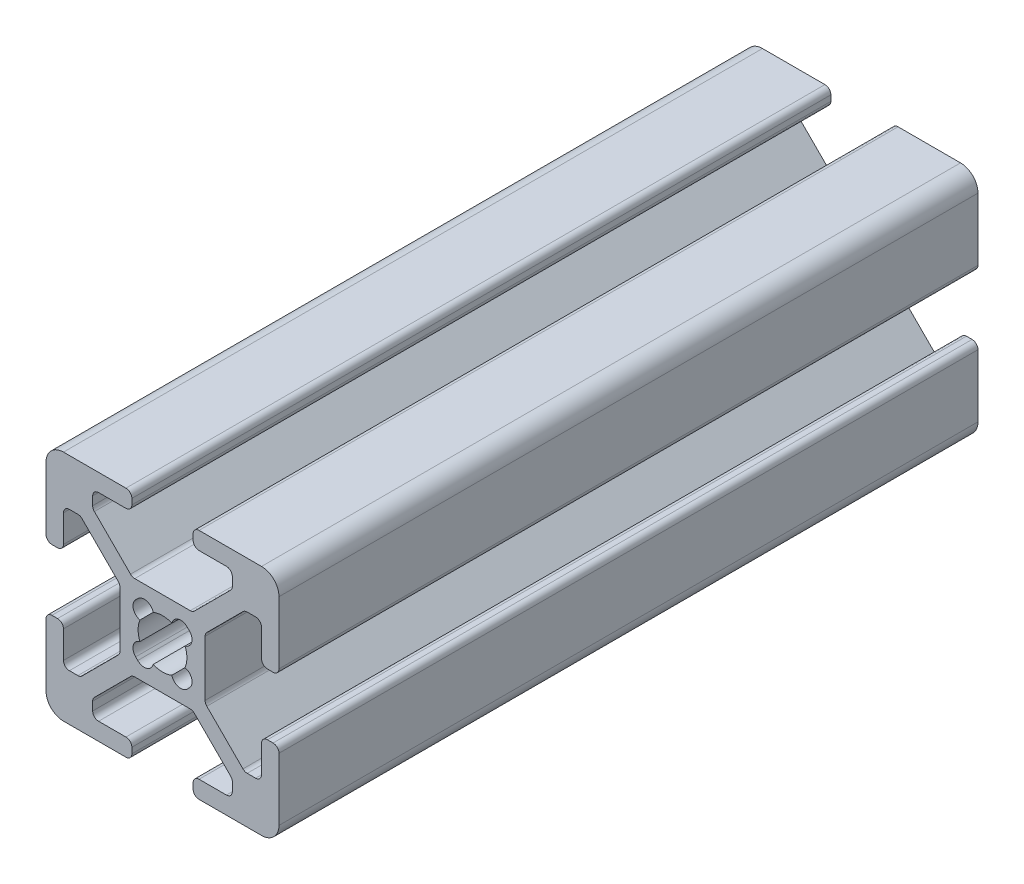
from build123d import *

# Parameters (mm, degrees)
BOSS_EXTRUDE1_DEPTH = 60


with BuildPart() as part:
    # Sketch2 → Boss-Extrude1 (new body)
    with BuildSketch(Plane.XY):
        with BuildLine():
            Line((-10, -3.138), (-10, -8.5))
            ThreePointArc((-10, -8.5), (-9.560660172, -9.560660172), (-8.5, -10))
            Line((-8.5, -10), (-3.138, -10))
            ThreePointArc((-3.138, -10), (-2.778789755, -9.851210245), (-2.63, -9.492))
            Line((-2.63, -9.492), (-2.63, -9.008))
            ThreePointArc((-2.63, -9.008), (-2.778789755, -8.648789755), (-3.138, -8.5))
            Line((-3.138, -8.5), (-5.487, -8.5))
            ThreePointArc((-5.487, -8.5), (-5.846210245, -8.351210245), (-5.995, -7.992))
            Line((-5.995, -7.992), (-5.995, -7.266240833))
            ThreePointArc((-5.995, -7.266240833), (-5.956330803, -7.07183765), (-5.846210245, -6.907030588))
            Line((-5.846210245, -6.907030588), (-2.742969412, -3.803789755))
            ThreePointArc((-2.742969412, -3.803789755), (-2.57816235, -3.693669197), (-2.383759167, -3.655))
            Line((-2.383759167, -3.655), (2.38407951, -3.655))
            ThreePointArc((2.38407951, -3.655), (2.578482694, -3.693669197), (2.743289755, -3.803789755))
            Line((2.743289755, -3.803789755), (5.846210245, -6.906710245))
            ThreePointArc((5.846210245, -6.906710245), (5.956330803, -7.071517306), (5.995, -7.26592049))
            Line((5.995, -7.26592049), (5.995, -7.992))
            ThreePointArc((5.995, -7.992), (5.846210245, -8.351210245), (5.487, -8.5))
            Line((5.487, -8.5), (3.138, -8.5))
            ThreePointArc((3.138, -8.5), (2.778789755, -8.648789755), (2.63, -9.008))
            Line((2.63, -9.008), (2.63, -9.492))
            ThreePointArc((2.63, -9.492), (2.778789755, -9.851210245), (3.138, -10))
            Line((3.138, -10), (8.5, -10))
            ThreePointArc((8.5, -10), (9.560660172, -9.560660172), (10, -8.5))
            Line((10, -8.5), (10, -3.138))
            ThreePointArc((10, -3.138), (9.851210245, -2.778789755), (9.492, -2.63))
            Line((9.492, -2.63), (9.008, -2.63))
            ThreePointArc((9.008, -2.63), (8.648789755, -2.778789755), (8.5, -3.138))
            Line((8.5, -3.138), (8.5, -5.487))
            ThreePointArc((8.5, -5.487), (8.351210245, -5.846210245), (7.992, -5.995))
            Line((7.992, -5.995), (7.266240833, -5.995))
            ThreePointArc((7.266240833, -5.995), (7.07183765, -5.956330803), (6.907030588, -5.846210245))
            Line((6.907030588, -5.846210245), (3.803789755, -2.742969412))
            ThreePointArc((3.803789755, -2.742969412), (3.693669197, -2.57816235), (3.655, -2.383759167))
            Line((3.655, -2.383759167), (3.655, 2.38407951))
            ThreePointArc((3.655, 2.38407951), (3.693669197, 2.578482694), (3.803789755, 2.743289755))
            Line((3.803789755, 2.743289755), (6.906710245, 5.846210245))
            ThreePointArc((6.906710245, 5.846210245), (7.071517306, 5.956330803), (7.26592049, 5.995))
            Line((7.26592049, 5.995), (7.992, 5.995))
            ThreePointArc((7.992, 5.995), (8.351210245, 5.846210245), (8.5, 5.487))
            Line((8.5, 5.487), (8.5, 3.138))
            ThreePointArc((8.5, 3.138), (8.648789755, 2.778789755), (9.008, 2.63))
            Line((9.008, 2.63), (9.492, 2.63))
            ThreePointArc((9.492, 2.63), (9.851210245, 2.778789755), (10, 3.138))
            Line((10, 3.138), (10, 8.5))
            ThreePointArc((10, 8.5), (9.560660172, 9.560660172), (8.5, 10))
            Line((8.5, 10), (3.138, 10))
            ThreePointArc((3.138, 10), (2.778789755, 9.851210245), (2.63, 9.492))
            Line((2.63, 9.492), (2.63, 9.008))
            ThreePointArc((2.63, 9.008), (2.778789755, 8.648789755), (3.138, 8.5))
            Line((3.138, 8.5), (5.487, 8.5))
            ThreePointArc((5.487, 8.5), (5.846210245, 8.351210245), (5.995, 7.992))
            Line((5.995, 7.992), (5.995, 7.266240833))
            ThreePointArc((5.995, 7.266240833), (5.956330803, 7.07183765), (5.846210245, 6.907030588))
            Line((5.846210245, 6.907030588), (2.742969412, 3.803789755))
            ThreePointArc((2.742969412, 3.803789755), (2.57816235, 3.693669197), (2.383759167, 3.655))
            Line((2.383759167, 3.655), (-2.38407951, 3.655))
            ThreePointArc((-2.38407951, 3.655), (-2.578482694, 3.693669197), (-2.743289755, 3.803789755))
            Line((-2.743289755, 3.803789755), (-5.846210245, 6.906710245))
            ThreePointArc((-5.846210245, 6.906710245), (-5.956330803, 7.071517306), (-5.995, 7.26592049))
            Line((-5.995, 7.26592049), (-5.995, 7.992))
            ThreePointArc((-5.995, 7.992), (-5.846210245, 8.351210245), (-5.487, 8.5))
            Line((-5.487, 8.5), (-3.138, 8.5))
            ThreePointArc((-3.138, 8.5), (-2.778789755, 8.648789755), (-2.63, 9.008))
            Line((-2.63, 9.008), (-2.63, 9.492))
            ThreePointArc((-2.63, 9.492), (-2.778789755, 9.851210245), (-3.138, 10))
            Line((-3.138, 10), (-8.5, 10))
            ThreePointArc((-8.5, 10), (-9.560660172, 9.560660172), (-10, 8.5))
            Line((-10, 8.5), (-10, 3.138))
            ThreePointArc((-10, 3.138), (-9.851210245, 2.778789755), (-9.492, 2.63))
            Line((-9.492, 2.63), (-9.008, 2.63))
            ThreePointArc((-9.008, 2.63), (-8.648789755, 2.778789755), (-8.5, 3.138))
            Line((-8.5, 3.138), (-8.5, 5.487))
            ThreePointArc((-8.5, 5.487), (-8.351210245, 5.846210245), (-7.992, 5.995))
            Line((-7.992, 5.995), (-7.266240833, 5.995))
            ThreePointArc((-7.266240833, 5.995), (-7.07183765, 5.956330803), (-6.907030588, 5.846210245))
            Line((-6.907030588, 5.846210245), (-3.803789755, 2.742969412))
            ThreePointArc((-3.803789755, 2.742969412), (-3.693669197, 2.57816235), (-3.655, 2.383759167))
            Line((-3.655, 2.383759167), (-3.655, -2.38407951))
            ThreePointArc((-3.655, -2.38407951), (-3.693669197, -2.578482694), (-3.803789755, -2.743289755))
            Line((-3.803789755, -2.743289755), (-6.906710245, -5.846210245))
            ThreePointArc((-6.906710245, -5.846210245), (-7.071517306, -5.956330803), (-7.26592049, -5.995))
            Line((-7.26592049, -5.995), (-7.992, -5.995))
            ThreePointArc((-7.992, -5.995), (-8.351210245, -5.846210245), (-8.5, -5.487))
            Line((-8.5, -5.487), (-8.5, -3.138))
            ThreePointArc((-8.5, -3.138), (-8.648789755, -2.778789755), (-9.008, -2.63))
            Line((-9.008, -2.63), (-9.492, -2.63))
            ThreePointArc((-9.492, -2.63), (-9.851210245, -2.778789755), (-10, -3.138))
        make_face()
        with BuildLine():
            Line((-2.124493037, 2.304493037), (-2.304493037, 2.124493037))
            ThreePointArc((-2.304493037, 2.124493037), (-2.506016078, 1.35638567), (-1.935777391, 0.803729988))
            ThreePointArc((-1.935777391, 0.803729988), (-2.096, 0), (-1.935777391, -0.803729988))
            ThreePointArc((-1.935777391, -0.803729988), (-2.506016078, -1.35638567), (-2.304493037, -2.124493037))
            Line((-2.304493037, -2.124493037), (-2.124493037, -2.304493037))
            ThreePointArc((-2.124493037, -2.304493037), (-1.35638567, -2.506016078), (-0.803729988, -1.935777391))
            ThreePointArc((-0.803729988, -1.935777391), (0, -2.096), (0.803729988, -1.935777391))
            ThreePointArc((0.803729988, -1.935777391), (1.35638567, -2.506016078), (2.124493037, -2.304493037))
            Line((2.124493037, -2.304493037), (2.304493037, -2.124493037))
            ThreePointArc((2.304493037, -2.124493037), (2.506016078, -1.35638567), (1.935777391, -0.803729988))
            ThreePointArc((1.935777391, -0.803729988), (2.096, 0), (1.935777391, 0.803729988))
            ThreePointArc((1.935777391, 0.803729988), (2.506016078, 1.35638567), (2.304493037, 2.124493037))
            Line((2.304493037, 2.124493037), (2.124493037, 2.304493037))
            ThreePointArc((2.124493037, 2.304493037), (1.35638567, 2.506016078), (0.803729988, 1.935777391))
            ThreePointArc((0.803729988, 1.935777391), (0, 2.096), (-0.803729988, 1.935777391))
            ThreePointArc((-0.803729988, 1.935777391), (-1.35638567, 2.506016078), (-2.124493037, 2.304493037))
        make_face(mode=Mode.SUBTRACT)
    extrude(amount=-BOSS_EXTRUDE1_DEPTH)


solid = part.part
